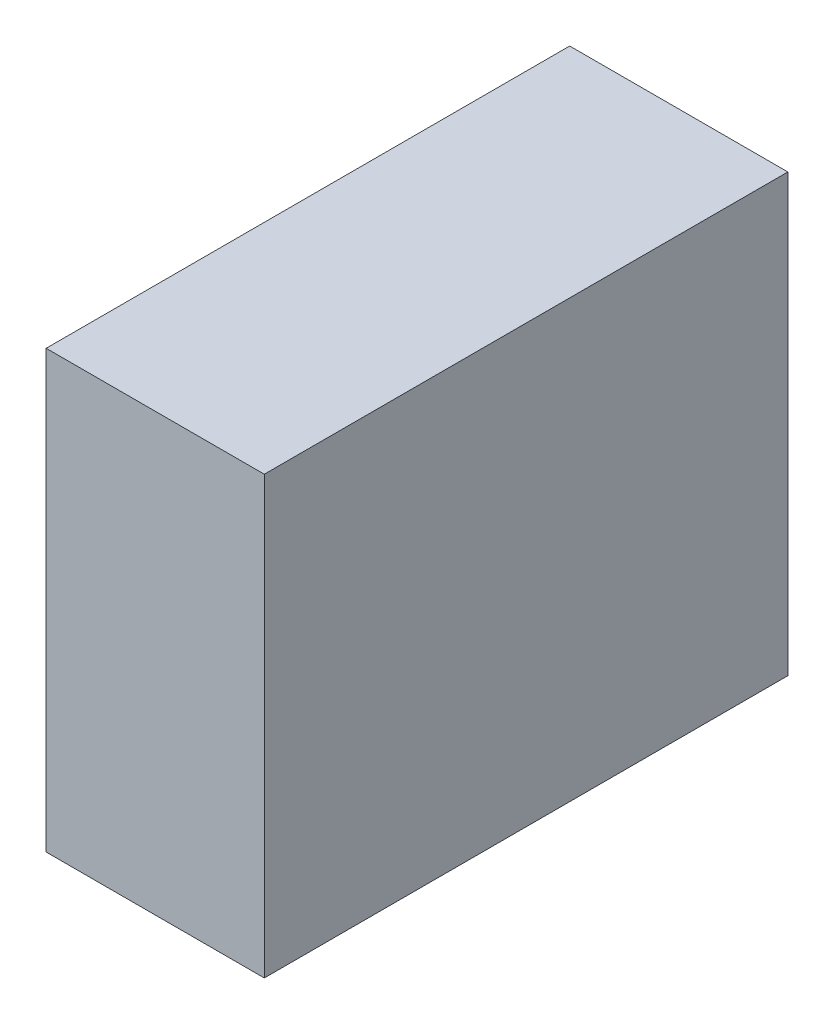
from build123d import *

# Parameters (mm, degrees)
OVEN_PANO_SURUCU_MENTESE_2_1_START = -128
SKETCH1_W                          = 50
SKETCH1_H                          = 100
OVEN_PANO_SURUCU_MENTESE_2_1_DEPTH = 120


with BuildPart() as part:
    # Sketch1 → OVEN_pano_surucu_mentese_2_1 (new body)
    with BuildSketch(Plane.XY.offset(OVEN_PANO_SURUCU_MENTESE_2_1_START)):
        with Locations((395, 250)):
            Rectangle(SKETCH1_W, SKETCH1_H)
    extrude(amount=-OVEN_PANO_SURUCU_MENTESE_2_1_DEPTH)


solid = part.part
